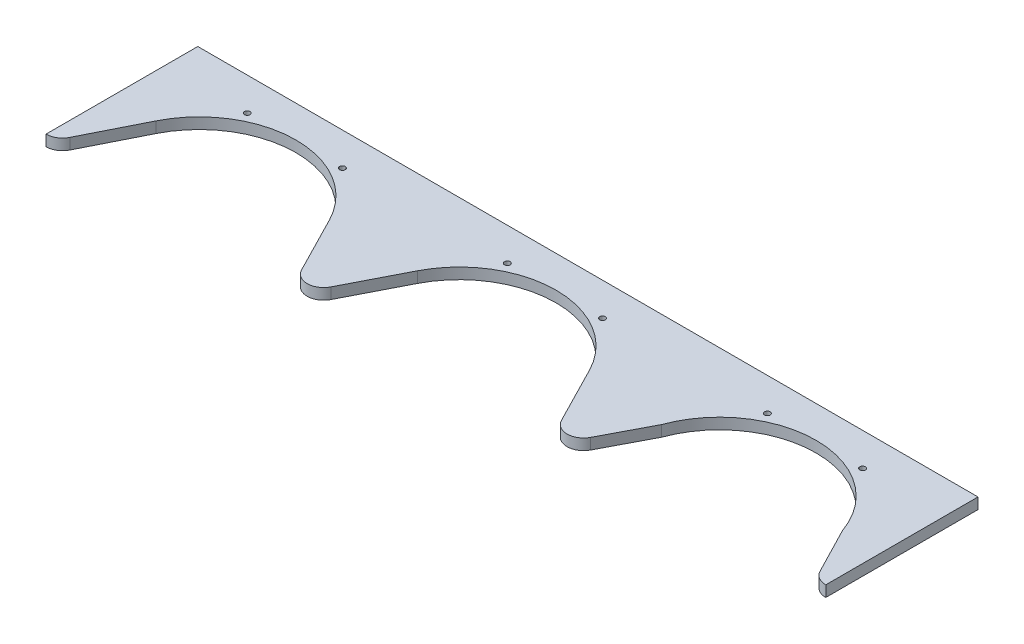
from build123d import *

# Parameters (mm, degrees)
SKETCH1_R           = 1.6383
BOSS_EXTRUDE1_DEPTH = 6.35
FILLET3_R           = 9.525


with BuildPart() as part:
    # Sketch1 → Boss-Extrude1 (new body)
    with BuildSketch(Plane(origin=(0, 0, 0), x_dir=(1, 0, 0), z_dir=(0, 1, 0))):
        with BuildLine():
            Line((-155.195517325, 13.78007871), (-129.789904869, -35.823423436))
            Line((-129.789904869, -35.823423436), (-104.384292413, 13.78007871))
            ThreePointArc((-104.384292413, 13.78007871), (-54.648238202, 44.186576564), (-4.912183992, 13.78007871))
            Line((-4.912183992, 13.78007871), (20.493428464, -35.823423436))
            Line((20.493428464, -35.823423436), (43.089138197, 7.319646013))
            ThreePointArc((43.089138197, 7.319646013), (95.947099994, 44.185705521), (148.390090675, 6.731691085))
            Line((148.390090675, 6.731691085), (162.314428993, -20.219790589))
            ThreePointArc((162.314428993, -20.219790589), (165.822867077, -23.983160647), (170.776761798, -25.372771775))
            Line((170.776761798, -25.372771775), (170.776761798, 62.601576564))
            Line((170.776761798, 62.601576564), (-280.073238202, 62.601576564))
            Line((-280.073238202, 62.601576564), (-280.073238202, -25.107798436))
            ThreePointArc((-280.073238202, -25.107798436), (-275.072672567, -23.689583762), (-271.561214661, -19.857266851))
            Line((-271.561214661, -19.857266851), (-254.868776311, 13.383457934))
            ThreePointArc((-254.868776311, 13.383457934), (-205.153928001, 44.186134164), (-155.195517325, 13.78007871))
        make_face()
        with Locations(Location((-232.439771536, 43.551576564, 0), (0, 0, 270))):
            Circle(SKETCH1_R, mode=Mode.SUBTRACT)
        with Locations(Location((-177.423371536, 43.551576564, 0), (0, 0, 270))):
            Circle(SKETCH1_R, mode=Mode.SUBTRACT)
        with Locations(Location((-27.140038202, 43.551576564, 0), (0, 0, 270))):
            Circle(SKETCH1_R, mode=Mode.SUBTRACT)
        with Locations(Location((-82.156438202, 43.551576564, 0), (0, 0, 270))):
            Circle(SKETCH1_R, mode=Mode.SUBTRACT)
        with Locations(Location((123.143295131, 43.551576564, 0), (0, 0, 270))):
            Circle(SKETCH1_R, mode=Mode.SUBTRACT)
        with Locations(Location((68.126895131, 43.551576564, 0), (0, 0, 270))):
            Circle(SKETCH1_R, mode=Mode.SUBTRACT)
    extrude(amount=-BOSS_EXTRUDE1_DEPTH)

    # Fillet3
    fillet3_edges = [part.edges().sort_by_distance(p)[0] for p in [
        (20.493428464, -3.175, 35.823423436),
        (-129.789904869, -3.175, 35.823423436),
    ]]
    fillet(fillet3_edges, radius=FILLET3_R)


solid = part.part
